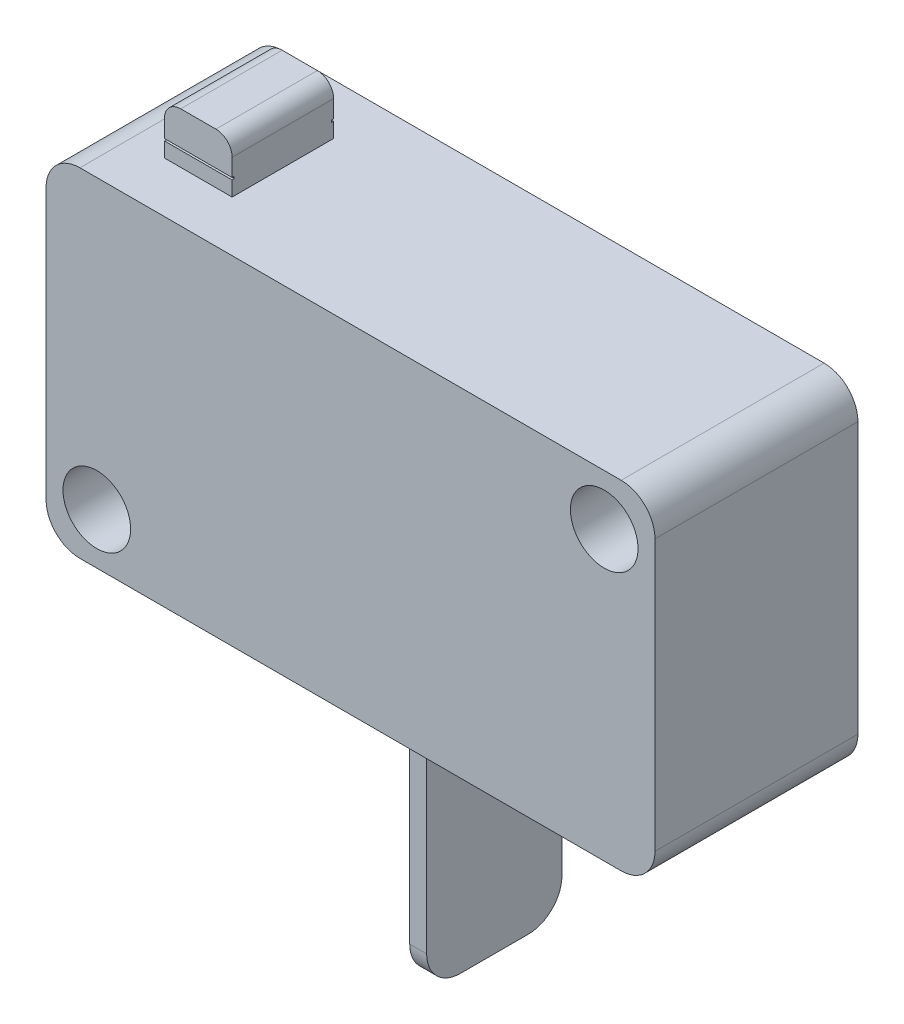
from build123d import *

# Parameters (mm, degrees)
SKETCH1_W           = 28.575
SKETCH1_H           = 15.875
SKETCH1_R           = 1.5875
BOSS_EXTRUDE1_DEPTH = 9.525
FILLET1_R           = 1.5875
SKETCH2_W           = 3.175
SKETCH2_H           = 4.7625
BOSS_EXTRUDE2_DEPTH = 2.38125
FILLET2_R           = 0.762
SKETCH3_W           = 0.79375
SKETCH3_H           = 6.35
BOSS_EXTRUDE3_DEPTH = 11.1125
FILLET3_R           = 1.5875
SKETCH4_W           = 3.175
SKETCH4_H           = 0.09921875
CUT_EXTRUDE1_DEPTH  = 0.09921875


with BuildPart() as part:
    # Sketch1 → Boss-Extrude1 (new body)
    with BuildSketch(Plane.XY):
        Rectangle(SKETCH1_W, SKETCH1_H)
        with Locations(Location((11.90625, 5.55625, 0), (0, 0, 180))):
            Circle(SKETCH1_R, mode=Mode.SUBTRACT)
        with Locations(Location((-11.90625, -5.55625, 0), (0, 0, 180))):
            Circle(SKETCH1_R, mode=Mode.SUBTRACT)
    extrude(amount=BOSS_EXTRUDE1_DEPTH)

    # Fillet1
    fillet1_edges = [part.edges().sort_by_distance(p)[0] for p in [
        (-14.2875, 7.9375, 4.7625),
        (14.2875, 7.9375, 4.7625),
        (14.2875, -7.9375, 4.7625),
        (-14.2875, -7.9375, 4.7625),
    ]]
    fillet(fillet1_edges, radius=FILLET1_R)

    # Sketch2 → Boss-Extrude2 (add)
    with BuildSketch(Plane(origin=(0, 7.9375, 0), x_dir=(1, 0, 0), z_dir=(0, 1, 0))):
        with Locations((-9.525, -4.7625)):
            Rectangle(SKETCH2_W, SKETCH2_H)
    extrude(amount=BOSS_EXTRUDE2_DEPTH)

    # Fillet2
    fillet2_edges = [part.edges().sort_by_distance(p)[0] for p in [
        (-11.1125, 10.31875, 4.7625),
        (-7.9375, 10.31875, 4.7625),
    ]]
    fillet(fillet2_edges, radius=FILLET2_R)

    # Sketch3 → Boss-Extrude3 (add)
    with BuildSketch(Plane(origin=(0, -7.9375, 0), x_dir=(-1, 0, 0), z_dir=(0, -1, 0))):
        with Locations((-1.5875, -4.7625)):
            Rectangle(SKETCH3_W, SKETCH3_H)
    extrude(amount=BOSS_EXTRUDE3_DEPTH)

    # Fillet3
    fillet3_edges = [part.edges().sort_by_distance(p)[0] for p in [
        (1.5875, -19.05, 1.5875),
        (1.5875, -19.05, 7.9375),
    ]]
    fillet(fillet3_edges, radius=FILLET3_R)

    # Sketch4 → Cut-Extrude1 (cut)
    with BuildSketch(Plane.XY.offset(7.14375)):
        with Locations((-9.525, 8.681640625)):
            Rectangle(SKETCH4_W, SKETCH4_H)
    cut_extrude1 = extrude(amount=-CUT_EXTRUDE1_DEPTH, mode=Mode.SUBTRACT)

    # Mirror1: Cut-Extrude1 across plane
    add(cut_extrude1.mirror(Plane.XY.offset(4.7625)), mode=Mode.SUBTRACT)


solid = part.part
